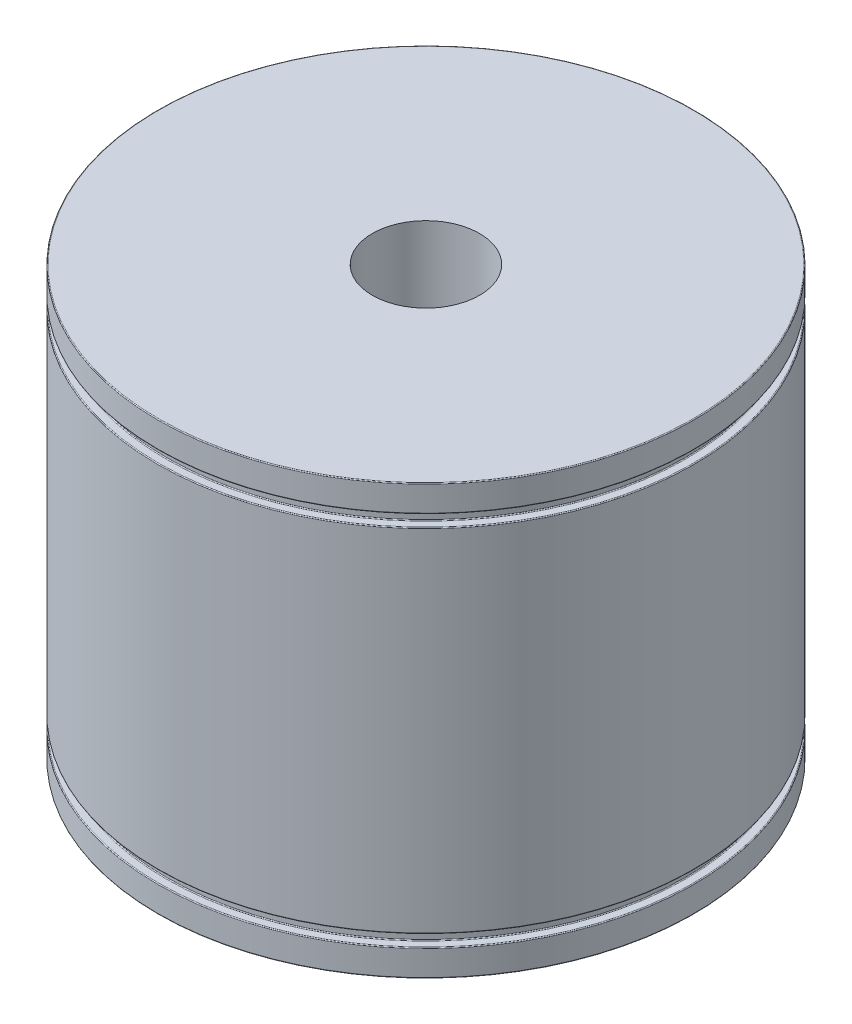
from build123d import *


with BuildPart() as part:
    # Croquis1 → Revolución1 (revolve)
    with BuildSketch(Plane.XY, mode=Mode.PRIVATE) as revoluci_n1_sk:
        with BuildLine():
            Line((6.35, 25.4), (6.35, -25.4))
            Line((6.35, -25.4), (31.65, -25.4))
            ThreePointArc((31.65, -25.4), (31.720710678, -25.370710678), (31.75, -25.3))
            Line((31.75, -25.3), (31.75, -22.33328768))
            ThreePointArc((31.75, -22.33328768), (31.720710678, -22.262577002), (31.65, -22.23328768))
            Line((31.65, -22.23328768), (30.798602544, -22.23328768))
            ThreePointArc((30.798602544, -22.23328768), (30.727891866, -22.203998358), (30.698602544, -22.13328768))
            Line((30.698602544, -22.13328768), (30.698602544, -20.936194686))
            ThreePointArc((30.698602544, -20.936194686), (30.727891866, -20.865484007), (30.798602544, -20.836194686))
            Line((30.798602544, -20.836194686), (31.65, -20.836194686))
            ThreePointArc((31.65, -20.836194686), (31.720710678, -20.806905364), (31.75, -20.736194686))
            Line((31.75, -20.736194686), (31.75, 20.736194686))
            ThreePointArc((31.75, 20.736194686), (31.720710678, 20.806905364), (31.65, 20.836194686))
            Line((31.65, 20.836194686), (30.798602544, 20.836194686))
            ThreePointArc((30.798602544, 20.836194686), (30.727891866, 20.865484007), (30.698602544, 20.936194686))
            Line((30.698602544, 20.936194686), (30.698602544, 22.13328768))
            ThreePointArc((30.698602544, 22.13328768), (30.727891866, 22.203998358), (30.798602544, 22.23328768))
            Line((30.798602544, 22.23328768), (31.65, 22.23328768))
            ThreePointArc((31.65, 22.23328768), (31.720710678, 22.262577002), (31.75, 22.33328768))
            Line((31.75, 22.33328768), (31.75, 25.3))
            ThreePointArc((31.75, 25.3), (31.720710678, 25.370710678), (31.65, 25.4))
            Line((31.65, 25.4), (6.35, 25.4))
        make_face()
    revolve(revoluci_n1_sk.sketch.rotate(Axis((0, 25.4, 0), (0, -1, 0)), 90), axis=Axis((0, 25.4, 0), (0, -1, 0)))


solid = part.part
